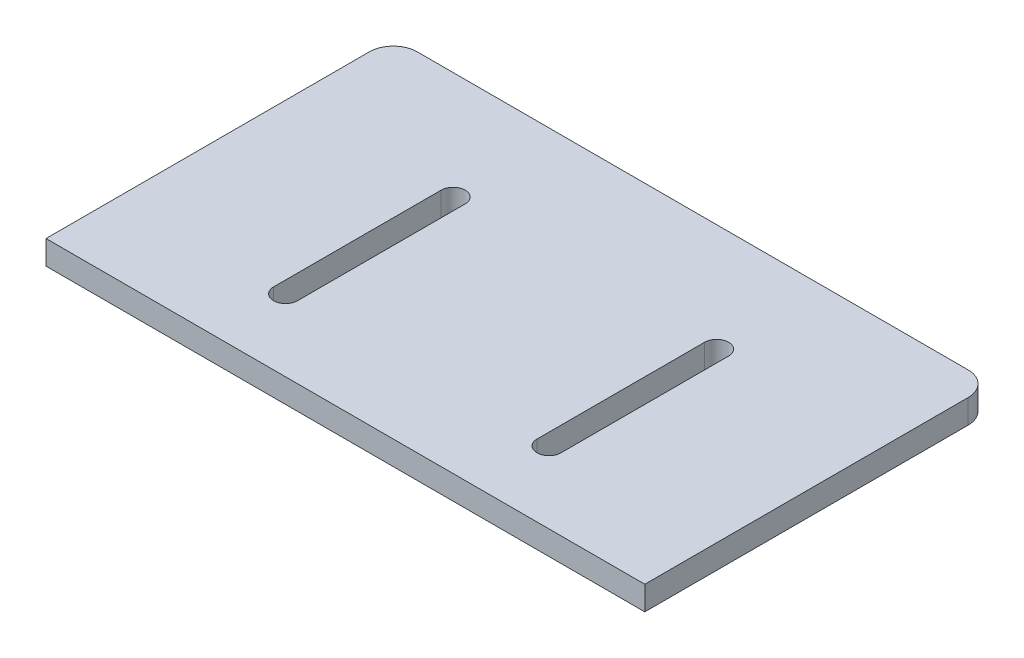
from build123d import *

# Parameters (mm, degrees)
RESSALTO_EXTRUS_O1_DEPTH = 2


with BuildPart() as part:
    # Esboço1 → Ressalto-extrusão1 (new body)
    with BuildSketch(Plane(origin=(0, 0, 0), x_dir=(1, 0, 0), z_dir=(0, 1, 0))):
        with BuildLine():
            Line((-23, 14.5), (23, 14.5))
            ThreePointArc((23, 14.5), (24.414213562, 13.914213562), (25, 12.5))
            Line((25, 12.5), (25, -14.5))
            Line((25, -14.5), (-25, -14.5))
            Line((-25, -14.5), (-25, 12.5))
            ThreePointArc((-25, 12.5), (-24.414213562, 13.914213562), (-23, 14.5))
        make_face()
        with BuildLine():
            Line((-10, 5.5), (-10, -8.5))
            ThreePointArc((-10, -8.5), (-11, -9.5), (-12, -8.5))
            Line((-12, -8.5), (-12, 5.5))
            ThreePointArc((-12, 5.5), (-11, 6.5), (-10, 5.5))
        make_face(mode=Mode.SUBTRACT)
        with BuildLine():
            Line((10, 5.5), (10, -8.5))
            ThreePointArc((10, -8.5), (11, -9.5), (12, -8.5))
            Line((12, -8.5), (12, 5.5))
            ThreePointArc((12, 5.5), (11, 6.5), (10, 5.5))
        make_face(mode=Mode.SUBTRACT)
    extrude(amount=RESSALTO_EXTRUS_O1_DEPTH)


solid = part.part
